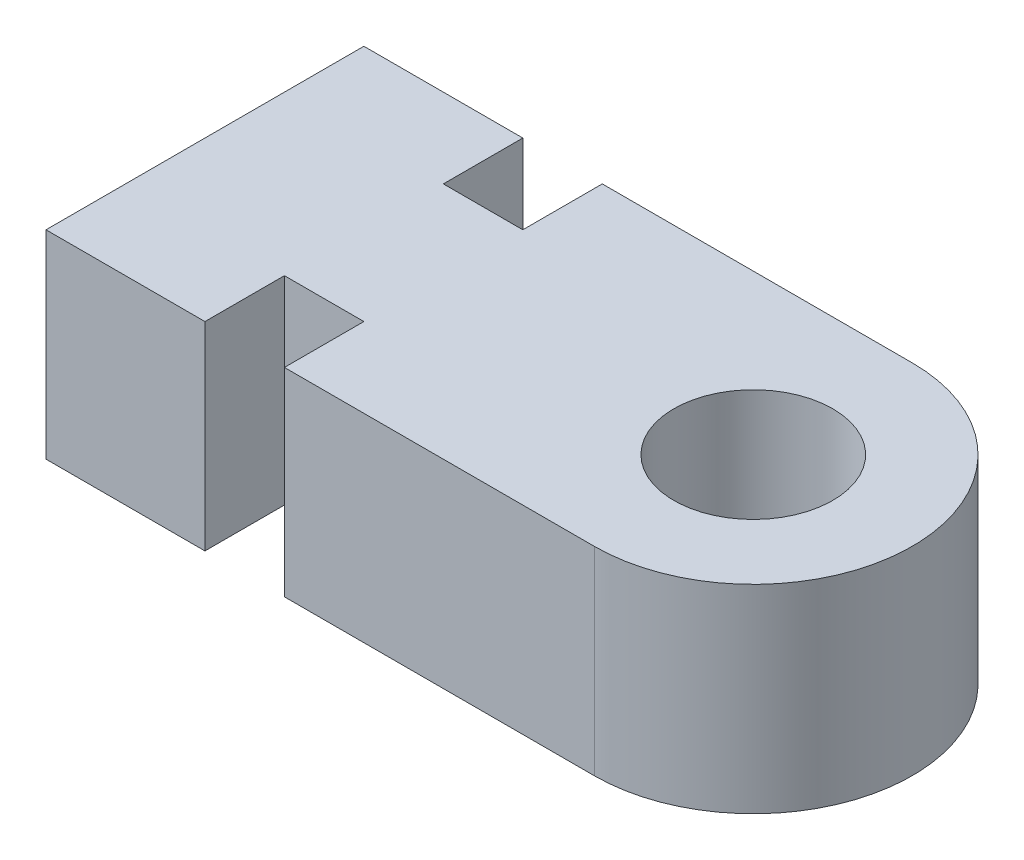
from build123d import *

# Parameters (mm, degrees)
SKETCH1_R           = 254
BOSS_EXTRUDE1_DEPTH = 635


with BuildPart() as part:
    # Sketch1 → Boss-Extrude1 (new body)
    with BuildSketch(Plane(origin=(0, 0, 0), x_dir=(1, 0, 0), z_dir=(0, 1, 0))):
        with BuildLine():
            Line((0, -508), (0, 508))
            Line((0, 508), (508, 508))
            Line((508, 508), (508, 254))
            Line((508, 254), (762, 254))
            Line((762, 254), (762, 508))
            Line((762, 508), (1752.6, 508))
            ThreePointArc((1752.6, 508), (2260.6, 0), (1752.6, -508))
            Line((1752.6, -508), (762, -508))
            Line((762, -508), (762, -254))
            Line((762, -254), (508, -254))
            Line((508, -254), (508, -508))
            Line((508, -508), (0, -508))
        make_face()
        with Locations(Location((1752.6, 0, 0), (0, 0, 90))):
            Circle(SKETCH1_R, mode=Mode.SUBTRACT)
    extrude(amount=BOSS_EXTRUDE1_DEPTH)


solid = part.part
